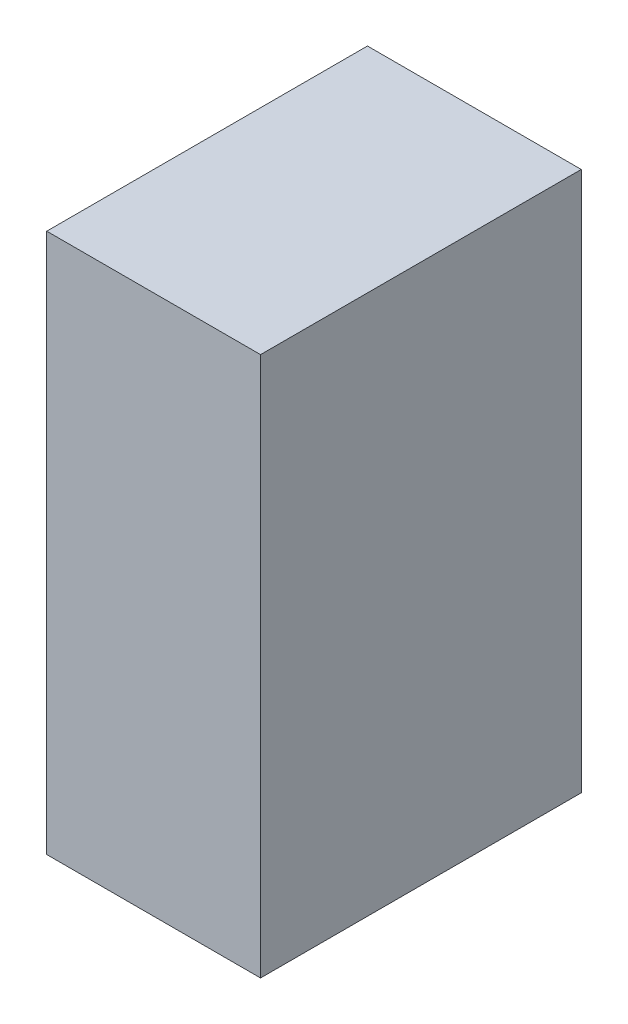
from build123d import *

# Parameters (mm, degrees)
SKETCH2_W           = 20
SKETCH2_H           = 50.5
BOSS_EXTRUDE1_DEPTH = 30
SHELL1_T            = -2
SKETCH4_W           = 3.5
SKETCH4_H           = 0.314102564
CUT_EXTRUDE1_DEPTH  = 0.001


with BuildPart() as part:
    # Sketch2 → Boss-Extrude1 (new body)
    with BuildSketch(Plane.XY):
        Rectangle(SKETCH2_W, SKETCH2_H)
    extrude(amount=BOSS_EXTRUDE1_DEPTH)

    # Shell1
    shell1_openings = [part.faces().sort_by_distance(p)[0] for p in [
        (-10, 0, 15),
    ]]
    offset(amount=SHELL1_T, openings=shell1_openings, kind=Kind.INTERSECTION)

    # Sketch4 → Cut-Extrude1 (cut)
    # profile 1 of 4: a face of its own
    with BuildSketch(Plane.XZ.offset(25.25)):
        with BuildLine():
            Line((10, 18.073717949), (6.5, 18.073717949))
            Line((6.5, 18.073717949), (6.5, 18.780448718))
            add(Edge.make_bspline(
                [(6.5, 18.780448718), (6.50044257, 18.841917706), (6.501297613, 18.960675471), (6.506719004, 19.132287919), (6.51630947, 19.291071681), (6.530278996, 19.43650454), (6.54743203, 19.568985752), (6.568932434, 19.688144361), (6.594320604, 19.794596503), (6.615966055, 19.860065944), (6.626201923, 19.891025641)],
                knots=[0, 0, 0, 0, 1.314313732, 2.53924729, 3.670748893, 4.714932338, 5.66265055, 6.526160246, 7.303039223, 8, 8, 8, 8], degree=3))
            add(Edge.make_bspline(
                [(6.626201923, 19.891025641), (6.641627823, 19.931524027), (6.672129816, 20.011602431), (6.729755877, 20.12555661), (6.794780526, 20.233197303), (6.868700162, 20.333666303), (6.950549517, 20.427215698), (7.039743862, 20.514907246), (7.138264609, 20.59457891), (7.244358149, 20.667471578), (7.356665124, 20.733211514), (7.475001605, 20.790349517), (7.59875844, 20.837803824), (7.72759369, 20.877196965), (7.861790039, 20.908243446), (8.001503913, 20.929425371), (8.146183101, 20.943396363), (8.244357565, 20.944800414), (8.294170673, 20.945512821)],
                knots=[0, 0, 0, 0, 0.984741985, 1.947153288, 2.898543998, 3.841229145, 4.778974371, 5.722123648, 6.681464302, 7.655713756, 8.646344578, 9.637374342, 10.639946623, 11.656849581, 12.698333139, 13.76849723, 14.867749466, 16, 16, 16, 16], degree=3))
            add(Edge.make_bspline(
                [(8.294170673, 20.945512821), (8.337431911, 20.944883853), (8.422682699, 20.943644405), (8.548323601, 20.932515097), (8.670237151, 20.916338751), (8.787842926, 20.891294646), (8.902170872, 20.860891797), (9.012004113, 20.821928875), (9.118344268, 20.777288871), (9.219775184, 20.725255569), (9.315809731, 20.668053965), (9.4064073, 20.607050171), (9.489557502, 20.540860668), (9.567439248, 20.471444464), (9.637972017, 20.397127597), (9.702441524, 20.318814865), (9.759768412, 20.236201923), (9.810853516, 20.148777373), (9.856537512, 20.055373639), (9.894643445, 19.9530527), (9.927647074, 19.842299231), (9.953901462, 19.722481631), (9.975075814, 19.594027254), (9.989173779, 19.456579764), (9.998734863, 19.310398919), (9.999570099, 19.210019306), (10, 19.158353365)],
                knots=[0, 0, 0, 0, 1.106010661, 2.179509527, 3.223302912, 4.248870533, 5.252098245, 6.246278179, 7.226402005, 8.199283979, 9.158616973, 10.083547221, 10.989831858, 11.874256832, 12.749262829, 13.607058236, 14.46581075, 15.317568432, 16.194266721, 17.121067875, 18.106207572, 19.147242834, 20.255495536, 21.43354536, 22.679031616, 24, 24, 24, 24], degree=3))
            Line((10, 19.158353365), (10, 18.073717949))
        make_face()
        with BuildLine():
            Line((9.641025641, 18.387820513), (9.641025641, 18.789563301))
            add(Edge.make_bspline(
                [(9.641025641, 18.789563301), (9.640777545, 18.847291672), (9.640300364, 18.95832447), (9.636113161, 19.117982468), (9.629271224, 19.263861864), (9.619696146, 19.395983374), (9.607027531, 19.514272398), (9.592902628, 19.618976148), (9.575305177, 19.709751406), (9.559354218, 19.764680843), (9.551983173, 19.790064103)],
                knots=[0, 0, 0, 0, 1.375205317, 2.645023457, 3.804390687, 4.853969522, 5.800190428, 6.637939096, 7.370582563, 8, 8, 8, 8], degree=3))
            add(Edge.make_bspline(
                [(9.551983173, 19.790064103), (9.540731617, 19.822012468), (9.518497248, 19.885146113), (9.477939556, 19.97602715), (9.429897598, 20.060784332), (9.376494915, 20.14089371), (9.31585044, 20.215222781), (9.249273718, 20.284637824), (9.176460575, 20.349053855), (9.09752908, 20.407478693), (9.013335152, 20.460398149), (8.923729887, 20.505827283), (8.829972999, 20.545390107), (8.731305473, 20.576716698), (8.628450489, 20.601416343), (8.520874701, 20.618729414), (8.4086733, 20.62947763), (8.3322895, 20.630759024), (8.293469551, 20.631410256)],
                knots=[0, 0, 0, 0, 0.998590647, 1.973329978, 2.929871262, 3.868367705, 4.809062953, 5.754642869, 6.701828697, 7.672172887, 8.647399344, 9.630604387, 10.631475358, 11.644913558, 12.679592956, 13.747988925, 14.855477812, 16, 16, 16, 16], degree=3))
            add(Edge.make_bspline(
                [(8.293469551, 20.631410256), (8.252536071, 20.630896969), (8.172121887, 20.629888611), (8.054131191, 20.617214301), (7.940650541, 20.598692746), (7.831672345, 20.57190906), (7.726983993, 20.537778181), (7.627164483, 20.495183539), (7.531159614, 20.44651692), (7.441185248, 20.388613583), (7.356092139, 20.325197989), (7.278137224, 20.25482011), (7.207142923, 20.178598072), (7.142003611, 20.097363222), (7.085339935, 20.008826123), (7.034653254, 19.915072432), (6.991637362, 19.814726761), (6.9687585, 19.744914065), (6.95713141, 19.709435096)],
                knots=[0, 0, 0, 0, 1.122418816, 2.205001699, 3.251619955, 4.274784885, 5.280384055, 6.268708349, 7.249350384, 8.229342522, 9.199999885, 10.157847722, 11.105861043, 12.055065948, 13.010012805, 13.98527497, 14.976112212, 16, 16, 16, 16], degree=3))
            add(Edge.make_bspline(
                [(6.95713141, 19.709435096), (6.949014982, 19.68008395), (6.93175723, 19.61767536), (6.912931857, 19.515835895), (6.896327358, 19.401220746), (6.882269319, 19.273321045), (6.872181998, 19.132282586), (6.864610683, 18.977996898), (6.859504051, 18.810397293), (6.859155343, 18.694214759), (6.858974359, 18.633914263)],
                knots=[0, 0, 0, 0, 0.674548936, 1.434276114, 2.292660221, 3.240891867, 4.284742987, 5.42552168, 6.663806718, 8, 8, 8, 8], degree=3))
            Line((6.858974359, 18.633914263), (6.858974359, 18.387820513))
            Line((6.858974359, 18.387820513), (9.641025641, 18.387820513))
        make_face(mode=Mode.SUBTRACT)
    # profile 2 of 4: a face of its own
    with BuildSketch(Plane.XZ.offset(25.25)):
        with Locations((8.25, 17.153846154)):
            Rectangle(SKETCH4_W, SKETCH4_H)
    # profile 3 of 4: a face of its own
    with BuildSketch(Plane.XZ.offset(25.25)):
        with BuildLine():
            Line((7.142227564, 16.278846154), (7.352564103, 16.00400641))
            add(Edge.make_bspline(
                [(7.352564103, 16.00400641), (7.329198442, 15.984400321), (7.28278214, 15.945452475), (7.217598054, 15.882796226), (7.156549782, 15.817483533), (7.09924508, 15.749605271), (7.047987144, 15.677590579), (6.998783962, 15.60418342), (6.955704883, 15.526716586), (6.903078399, 15.420138723), (6.849360057, 15.280173065), (6.803157646, 15.104588223), (6.774023468, 14.921042405), (6.770846635, 14.795849591), (6.769230769, 14.732171474)],
                knots=[0, 0, 0, 0, 0.75789156, 1.505565099, 2.245254514, 2.979266606, 3.711207489, 4.440978832, 5.174393176, 5.91211879, 7.394186119, 8.890401545, 10.418332761, 12, 12, 12, 12], degree=3))
            add(Edge.make_bspline(
                [(6.769230769, 14.732171474), (6.769634732, 14.697088175), (6.770438908, 14.627247182), (6.781048033, 14.523598709), (6.795959243, 14.421885658), (6.818084566, 14.322174192), (6.846057184, 14.224591232), (6.879482602, 14.128498834), (6.920837429, 14.035288218), (6.966545735, 13.943670041), (7.018173011, 13.855890604), (7.074486973, 13.772836377), (7.134853847, 13.694805417), (7.199513113, 13.621753793), (7.268124966, 13.553541301), (7.341458086, 13.491026297), (7.418728518, 13.433373532), (7.500000431, 13.38091158), (7.584516904, 13.33368364), (7.672760474, 13.293972287), (7.763220234, 13.259288659), (7.856537478, 13.231412022), (7.952091972, 13.209518588), (8.050279572, 13.194382475), (8.150914118, 13.183896302), (8.219123313, 13.183095812), (8.253505609, 13.182692308)],
                knots=[0, 0, 0, 0, 1.054877232, 2.099964208, 3.13098259, 4.145888998, 5.169474743, 6.183358035, 7.203388855, 8.234598956, 9.261847606, 10.264062591, 11.251197969, 12.227332808, 13.196685059, 14.158975844, 15.123498106, 16.094582253, 17.066912473, 18.032714859, 19.002806091, 19.979168736, 20.95977404, 21.949109834, 22.966205168, 24, 24, 24, 24], degree=3))
            add(Edge.make_bspline(
                [(8.253505609, 13.182692308), (8.305235776, 13.183957085), (8.406801096, 13.186440309), (8.555588077, 13.208446642), (8.698262935, 13.242156032), (8.833859633, 13.291850073), (8.963508531, 13.354348215), (9.085637373, 13.432328662), (9.202035382, 13.522985507), (9.309883465, 13.627248771), (9.408395797, 13.741657613), (9.495146748, 13.864404722), (9.567461533, 13.995189222), (9.627637506, 14.132565795), (9.673894226, 14.277591925), (9.706458351, 14.430006723), (9.727700531, 14.58947872), (9.72973422, 14.698448119), (9.730769231, 14.75390625)],
                knots=[0, 0, 0, 0, 1.029159485, 2.020618137, 2.987588728, 3.942669054, 4.889339625, 5.846988364, 6.821327795, 7.821533711, 8.827683044, 9.822769455, 10.807800696, 11.797391277, 12.803701919, 13.832062008, 14.896664671, 16, 16, 16, 16], degree=3))
            add(Edge.make_bspline(
                [(9.730769231, 14.75390625), (9.729080451, 14.815008939), (9.725756528, 14.935273648), (9.697597279, 15.111641674), (9.651939362, 15.28047744), (9.588041439, 15.441790026), (9.504976151, 15.595124673), (9.404278274, 15.740721333), (9.284989941, 15.878702903), (9.193906813, 15.961674186), (9.147435897, 16.00400641)],
                knots=[0, 0, 0, 0, 1.028121516, 2.023589091, 2.998037872, 3.967518031, 4.937445131, 5.927275754, 6.942489185, 8, 8, 8, 8], degree=3))
            Line((9.147435897, 16.00400641), (9.355669071, 16.278846154))
            add(Edge.make_bspline(
                [(9.355669071, 16.278846154), (9.384206535, 16.256727268), (9.441144771, 16.212595446), (9.521431128, 16.141148931), (9.596880443, 16.065828665), (9.667115924, 15.986441042), (9.732428286, 15.902846139), (9.792853008, 15.815051625), (9.848069416, 15.723132441), (9.898788398, 15.627818692), (9.943444742, 15.528890745), (9.983016786, 15.427219506), (10.015778067, 15.322181586), (10.043490435, 15.214661173), (10.063250601, 15.103687204), (10.078986048, 14.990549669), (10.088321482, 14.87418964), (10.089265301, 14.79575635), (10.08974359, 14.756009615)],
                knots=[0, 0, 0, 0, 0.986911346, 1.969095443, 2.935967484, 3.900112155, 4.865124501, 5.834589912, 6.812044781, 7.795288262, 8.784678562, 9.777857908, 10.776141921, 11.791195789, 12.811324908, 13.855933174, 14.913475973, 16, 16, 16, 16], degree=3))
            add(Edge.make_bspline(
                [(10.08974359, 14.756009615), (10.089481597, 14.718365948), (10.088963539, 14.643930258), (10.080571372, 14.534031507), (10.069121635, 14.427041926), (10.051881504, 14.3232673), (10.031537164, 14.222141325), (10.004265907, 14.12458074), (9.973716741, 14.02962553), (9.937811754, 13.937657189), (9.897295571, 13.84859749), (9.851504013, 13.762733678), (9.800822148, 13.680105246), (9.746367137, 13.599899825), (9.686389836, 13.523302241), (9.621723201, 13.449648716), (9.55258519, 13.37852624), (9.502730337, 13.334523555), (9.477664263, 13.31239984)],
                knots=[0, 0, 0, 0, 1.114604814, 2.203992996, 3.262667896, 4.300477797, 5.318619304, 6.316056647, 7.298880507, 8.271930387, 9.238335007, 10.195173496, 11.151986948, 12.108099108, 13.064862484, 14.031167946, 15.010108607, 16, 16, 16, 16], degree=3))
            add(Edge.make_bspline(
                [(9.477664263, 13.31239984), (9.434122176, 13.276966508), (9.34756368, 13.206527625), (9.207290924, 13.116367912), (9.060964695, 13.039448999), (8.907737447, 12.976562981), (8.747549613, 12.928259183), (8.580658888, 12.894298473), (8.407398896, 12.872383679), (8.289563768, 12.869868317), (8.229667468, 12.868589744)],
                knots=[0, 0, 0, 0, 0.994611881, 1.977215934, 2.950189954, 3.921972279, 4.908960509, 5.911694611, 6.938501887, 8, 8, 8, 8], degree=3))
            add(Edge.make_bspline(
                [(8.229667468, 12.868589744), (8.166712014, 12.870144937), (8.04285109, 12.873204683), (7.861077137, 12.899200479), (7.686925738, 12.941019275), (7.520721993, 13.000416164), (7.361591713, 13.075721515), (7.210750508, 13.168748129), (7.067233708, 13.278415271), (6.933218957, 13.403862839), (6.810679604, 13.541430174), (6.702873401, 13.688748988), (6.613155885, 13.845530935), (6.538159722, 14.010048787), (6.480515259, 14.183534468), (6.440162072, 14.365617837), (6.415044956, 14.555956752), (6.411869748, 14.685819178), (6.41025641, 14.751802885)],
                knots=[0, 0, 0, 0, 1.032925535, 2.032216505, 3.007276963, 3.968222605, 4.92396291, 5.891752235, 6.871517503, 7.883894988, 8.900124299, 9.891468569, 10.874487609, 11.85992873, 12.854644235, 13.869047385, 14.917252991, 16, 16, 16, 16], degree=3))
            add(Edge.make_bspline(
                [(6.41025641, 14.751802885), (6.410738968, 14.792017225), (6.411694142, 14.871617461), (6.420994206, 14.989372025), (6.436530157, 15.104007323), (6.457564815, 15.215643916), (6.484053723, 15.324604553), (6.517067386, 15.430685388), (6.556372473, 15.533626654), (6.60125706, 15.63339491), (6.651729522, 15.729316665), (6.70719452, 15.8213317), (6.767371805, 15.909073177), (6.832877455, 15.992085053), (6.90316811, 16.070468892), (6.977420411, 16.145387445), (7.05753973, 16.214659904), (7.113946611, 16.257411572), (7.142227564, 16.278846154)],
                knots=[0, 0, 0, 0, 1.096622143, 2.170653093, 3.219033441, 4.250379162, 5.267604342, 6.275621678, 7.278284436, 8.271072515, 9.257558938, 10.232633088, 11.19973724, 12.157384997, 13.114417402, 14.069920322, 15.032307892, 16, 16, 16, 16], degree=3))
        make_face()
    # profile 4 of 4: a face of its own
    with BuildSketch(Plane.XZ.offset(25.25)):
        Polygon((6.5, 10.894230769), (10, 12.509615385), (10, 12.168169071), (8.878205128, 11.650741186), (8.878205128, 10.064102564), (10, 9.532652244), (10, 9.189102564), (6.5, 10.849358974), align=None)
        Polygon((7.182892628, 10.868289263), (8.519230769, 10.235176282), (8.519230769, 11.485276442), align=None, mode=Mode.SUBTRACT)
    extrude(amount=-CUT_EXTRUDE1_DEPTH, mode=Mode.SUBTRACT)


solid = part.part
